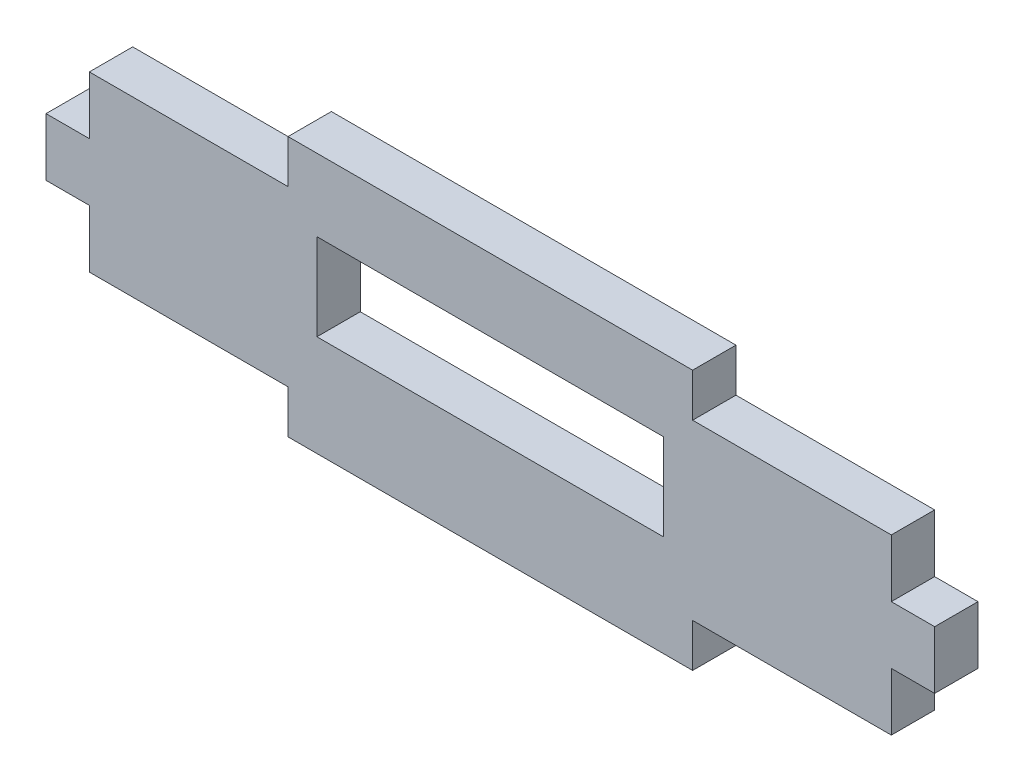
from build123d import *

# Parameters (mm, degrees)
SKETCH1_W           = 24
SKETCH1_H           = 6
BOSS_EXTRUDE1_DEPTH = 3


with BuildPart() as part:
    # Sketch1 → Boss-Extrude1 (new body)
    with BuildSketch(Plane.XY):
        Polygon((-14, -9), (14, -9), (14, -6), (27.75, -6), (27.75, -2), (30.75, -2), (30.75, 2), (27.75, 2), (27.75, 6), (14, 6), (14, 9), (-14, 9), (-14, 6), (-27.75, 6), (-27.75, 2), (-30.75, 2), (-30.75, -2), (-27.75, -2), (-27.75, -6), (-14, -6), align=None)
        with Locations((0, 1)):
            Rectangle(SKETCH1_W, SKETCH1_H, mode=Mode.SUBTRACT)
    extrude(amount=BOSS_EXTRUDE1_DEPTH)


solid = part.part
